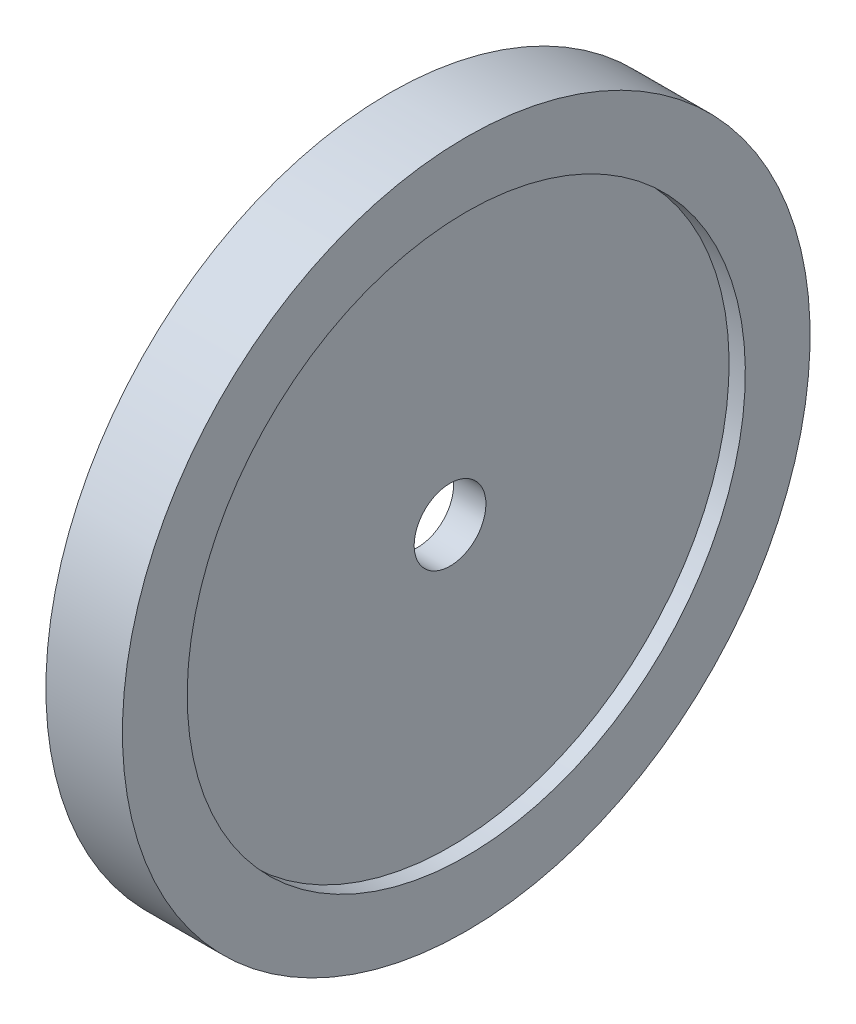
from build123d import *

# Parameters (mm, degrees)
SKETCH2_R           = 17.5
SKETCH2_R_2         = 11.5
BOSS_EXTRUDE1_DEPTH = 1.5
SKETCH4_R           = 3.6
CUT_EXTRUDE2_DEPTH  = 50.033808745


with BuildPart() as part:
    # Sketch1 → Revolve1 (revolve)
    with BuildSketch(Plane.XY):
        Polygon((0, 0), (0, 28), (-2.8, 28), (-2.8, 34.5), (4.88, 34.5), (4.88, 28), (3.25, 28), (3.25, 0), align=None)
    revolve(axis=Axis((3.25, 0, 0), (-1, 0, 0)))

    # Sketch2 → Boss-Extrude1 (add)
    with BuildSketch(Plane.ZY):
        with Locations(Location((0, 0, 0), (0, 0, 270))):
            Circle(SKETCH2_R)
        with Locations(Location((0, 0, 0), (0, 0, 270))):
            Circle(SKETCH2_R_2, mode=Mode.SUBTRACT)
    extrude(amount=BOSS_EXTRUDE1_DEPTH)

    # Sketch4 → Cut-Extrude2 (cut, through all)
    with BuildSketch(Plane(origin=(0, 0, 0), x_dir=(0, 0, -1), z_dir=(1, 0, 0))):
        with Locations(Location((0, 0, 0), (0, 0, 90))):
            Circle(SKETCH4_R)
    extrude(amount=CUT_EXTRUDE2_DEPTH, mode=Mode.SUBTRACT)


solid = part.part
